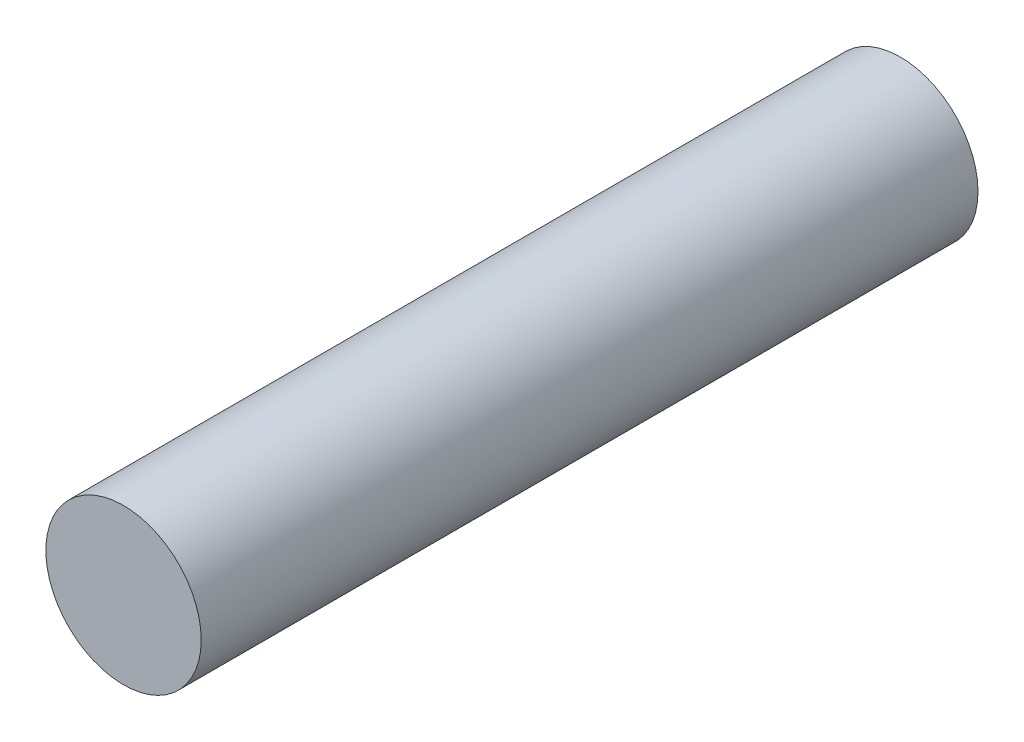
from build123d import *

# Parameters (mm, degrees)
BOSS_EXTRUDE1_DEPTH      = 4.445
BOSS_EXTRUDE1_DEPTH_BACK = 4.445
SKETCH3_R                = 0.889


with BuildPart() as part:
    # Sketch3 → Boss-Extrude1 (new, two sides: drawn at the far end of the back side and taken through both)
    with BuildSketch(Plane.XY.offset(-BOSS_EXTRUDE1_DEPTH_BACK)):
        Circle(SKETCH3_R)
    extrude(amount=BOSS_EXTRUDE1_DEPTH + BOSS_EXTRUDE1_DEPTH_BACK)


solid = part.part
